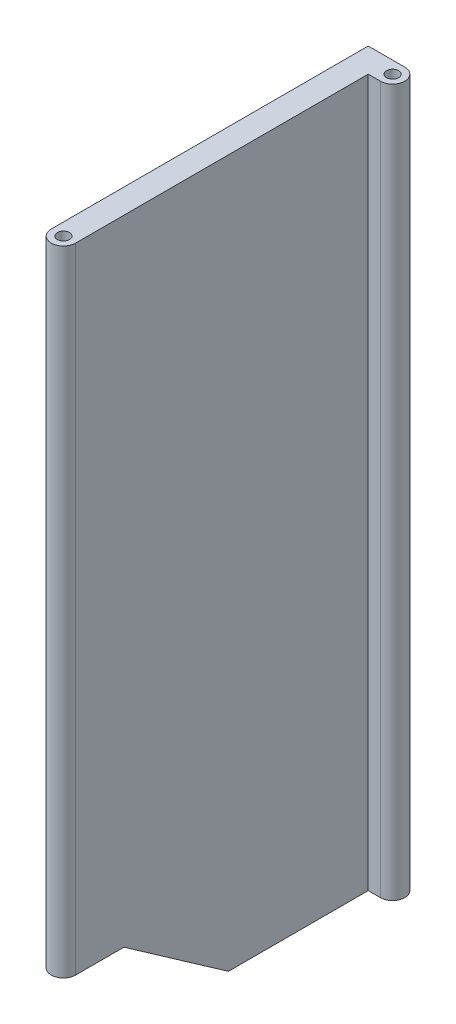
from build123d import *

# Parameters (mm, degrees)
EXTRUDE_1_DEPTH = 2
SKETCH_3_R      = 0.5
EXTRUDE_3_DEPTH = 52
SKETCH_4_R      = 0.5
EXTRUDE_4_DEPTH = 58


with BuildPart() as part:
    # Эскиз1 → Бобышка-Вытянуть1 (new body)
    with BuildSketch(Plane(origin=(0, 0, 0), x_dir=(0, 0, -1), z_dir=(1, 0, 0))):
        Polygon((-25, 6), (-22.034972426, 6), (-13.466084386, 0), (0, 0), (0, 58), (-25, 58), align=None)
    extrude(amount=EXTRUDE_1_DEPTH)

    # Эскиз3 → Бобышка-Вытянуть3 (add)
    with BuildSketch(Plane.XZ.offset(-6)):
        with BuildLine():
            Line((0, 25), (0, 26))
            ThreePointArc((0, 26), (1, 27), (2, 26))
            Line((2, 26), (2, 25))
            Line((2, 25), (0, 25))
        make_face()
        with Locations(Location((1, 26, 0), (0, 0, 270))):
            Circle(SKETCH_3_R, mode=Mode.SUBTRACT)
    extrude(amount=-EXTRUDE_3_DEPTH)

    # Эскиз4 → Бобышка-Вытянуть4 (add)
    with BuildSketch(Plane(origin=(0, 0, 0), x_dir=(1, 0, 0), z_dir=(0, 1, 0))):
        with BuildLine():
            Line((3, 0), (2, 0))
            Line((2, 0), (2, -2))
            Line((2, -2), (3, -2))
            ThreePointArc((3, -2), (4, -1), (3, 0))
        make_face()
        with Locations(Location((3, -1, 0), (0, 0, 90))):
            Circle(SKETCH_4_R, mode=Mode.SUBTRACT)
    extrude(amount=EXTRUDE_4_DEPTH)


solid = part.part
